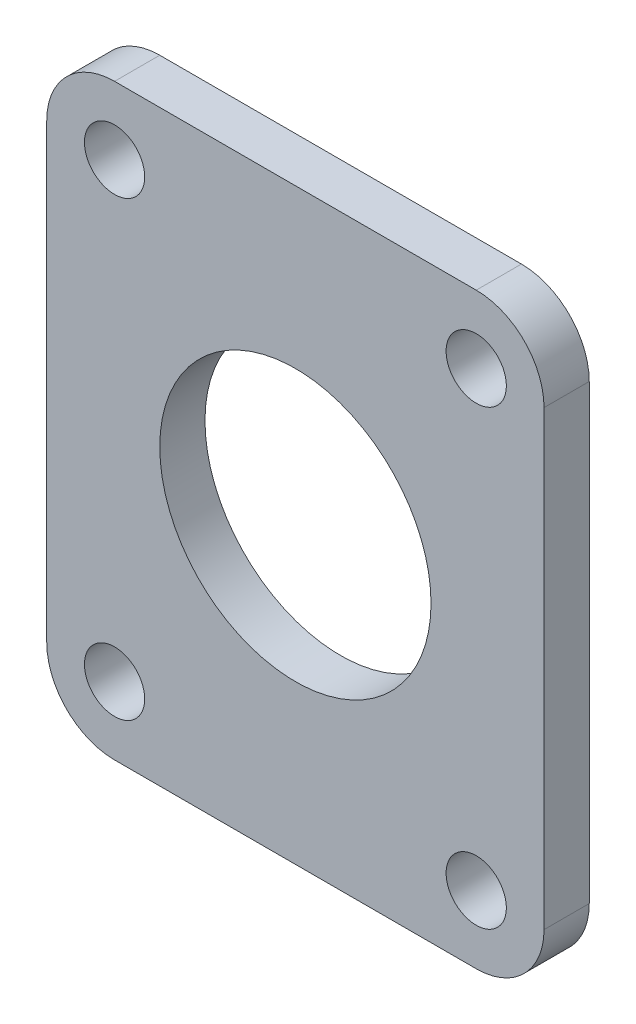
from build123d import *

# Parameters (mm, degrees)
MODEL_R                 = 2
MODEL_R_2               = 9
SALIENTE_EXTRUIR1_DEPTH = 3


with BuildPart() as part:
    # Model → Saliente-Extruir1 (new body)
    with BuildSketch(Plane.XY):
        with BuildLine():
            Line((648.870989369, 460.456018304), (648.870989369, 430.456018304))
            ThreePointArc((648.870989369, 430.456018304), (650.189008853, 427.274037789), (653.370989369, 425.956018304))
            Line((653.370989369, 425.956018304), (677.370989369, 425.956018304))
            ThreePointArc((677.370989369, 425.956018304), (680.552969884, 427.274037789), (681.870989369, 430.456018304))
            Line((681.870989369, 430.456018304), (681.870989369, 460.456018304))
            ThreePointArc((681.870989369, 460.456018304), (680.552969884, 463.637998819), (677.370989369, 464.956018304))
            Line((677.370989369, 464.956018304), (653.370989369, 464.956018304))
            ThreePointArc((653.370989369, 464.956018304), (650.189008853, 463.637998819), (648.870989369, 460.456018304))
        make_face()
        with Locations((677.370989369, 430.456018304)):
            Circle(MODEL_R, mode=Mode.SUBTRACT)
        with Locations((677.370989369, 460.456018304)):
            Circle(MODEL_R, mode=Mode.SUBTRACT)
        with Locations((653.370989369, 460.456018304)):
            Circle(MODEL_R, mode=Mode.SUBTRACT)
        with Locations((653.370989369, 430.456018304)):
            Circle(MODEL_R, mode=Mode.SUBTRACT)
        with Locations((665.370989369, 445.456018304)):
            Circle(MODEL_R_2, mode=Mode.SUBTRACT)
    extrude(amount=SALIENTE_EXTRUIR1_DEPTH)


solid = part.part
